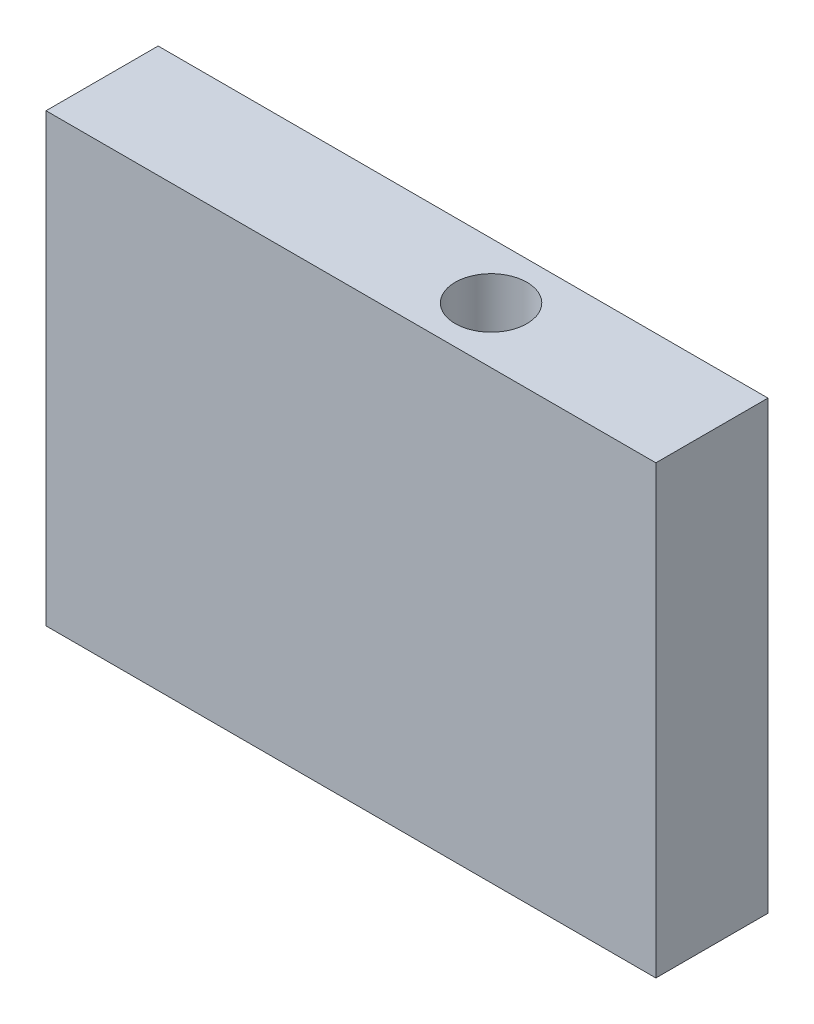
from build123d import *

# Parameters (mm, degrees)
ESQUISSE1_W             = 27.2
ESQUISSE1_H             = 19.9
EXTRUSION1_DEPTH        = 5
ESQUISSE2_R             = 1.6
ENL_V_MAT_EXTRU_1_DEPTH = 35.071248876


with BuildPart() as part:
    # Esquisse1 → Extrusion1 (new body)
    with BuildSketch(Plane.XY):
        with Locations((-13.6, 9.95)):
            Rectangle(ESQUISSE1_W, ESQUISSE1_H)
    extrude(amount=EXTRUSION1_DEPTH)

    # Esquisse2 → Enlèv. mat.-Extru.1 (cut, through all)
    with BuildSketch(Plane(origin=(0, 19.9, 0), x_dir=(1, 0, 0), z_dir=(0, 1, 0))):
        with Locations(Location((-9.85, -2.5, 0), (0, 0, 180))):
            Circle(ESQUISSE2_R)
    extrude(amount=-ENL_V_MAT_EXTRU_1_DEPTH, mode=Mode.SUBTRACT)


solid = part.part
